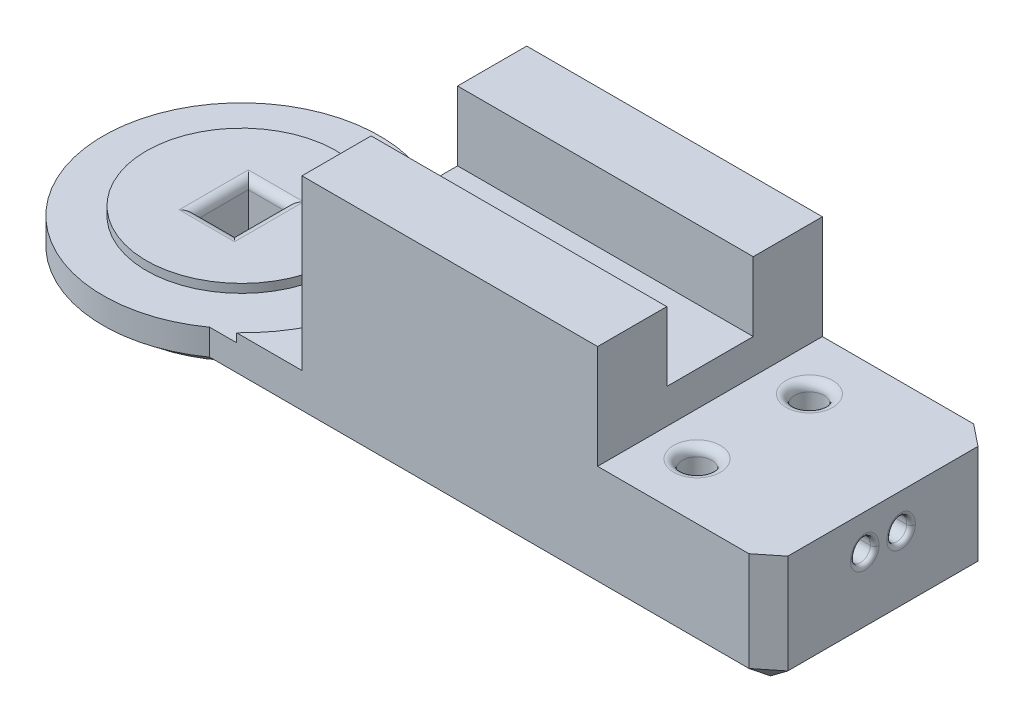
from build123d import *
from OCP.BRepFilletAPI import BRepFilletAPI_MakeChamfer

# Parameters (mm, degrees)
BOSS_EXTRUDE1_DEPTH     = 3
SKETCH2_R               = 9
SKETCH2_R_2             = 5.5
CUT_EXTRUDE1_DEPTH      = 0.5
SKETCH3_W               = 22.1
SKETCH3_H               = 13
BOSS_EXTRUDE2_DEPTH     = 3.75
CUT_EXTRUDE2_DEPTH      = 34.76347879
CUT_EXTRUDE2_DEPTH_BACK = 34.76347879
SKETCH4_R               = 0.85
BOSS_EXTRUDE3_START     = -6.75
SKETCH5_W               = 5
SKETCH5_H               = 13
BOSS_EXTRUDE3_DEPTH     = 6.75
CHAMFER1_SIZE           = 1
CHAMFER1_SIZE2          = 1.25
FILLET1_R               = 0.5
CUT_EXTRUDE3_DEPTH      = 29.503903241
FILLET2_R               = 0.25
SKETCH7_W               = 17.1
SKETCH7_H               = 13
BOSS_EXTRUDE4_DEPTH     = 6
SKETCH8_W               = 17.1
SKETCH8_H               = 5
CUT_EXTRUDE4_DEPTH      = 4


with BuildPart() as part:
    # Sketch1 → Boss-Extrude1 (new body)
    with BuildSketch(Plane(origin=(0, 0, 0), x_dir=(1, 0, 0), z_dir=(0, 1, 0))):
        with BuildLine():
            Line((32.1, 6.5), (4.663689527, 6.5))
            ThreePointArc((4.663689527, 6.5), (-8, 0), (4.663689527, -6.5))
            Line((4.663689527, -6.5), (32.1, -6.5))
            Line((32.1, -6.5), (32.1, 6.5))
        make_face()
        Polygon((-1.1, -1.019803903), (-1.1, 1.019803903), (-1.1, 1.5), (1.1, 1.5), (1.1, 1.019803903), (1.1, -1.019803903), (1.1, -1.5), (-1.1, -1.5), align=None, mode=Mode.SUBTRACT)
    extrude(amount=-BOSS_EXTRUDE1_DEPTH)

    # Sketch2 → Cut-Extrude1 (cut)
    with BuildSketch(Plane(origin=(0, 0, 0), x_dir=(1, 0, 0), z_dir=(0, 1, 0))):
        Circle(SKETCH2_R)
        with Locations(Location((0, 0, 0), (0, 0, 180))):
            Circle(SKETCH2_R_2, mode=Mode.SUBTRACT)
    extrude(amount=-CUT_EXTRUDE1_DEPTH, mode=Mode.SUBTRACT)

    # Sketch3 → Boss-Extrude2 (add)
    with BuildSketch(Plane(origin=(0, 0, 0), x_dir=(1, 0, 0), z_dir=(0, 1, 0))):
        with Locations((21.05, 0)):
            Rectangle(SKETCH3_W, SKETCH3_H)
    extrude(amount=BOSS_EXTRUDE2_DEPTH)

    # Sketch4 → Cut-Extrude2 (cut, two sides: drawn at the far end of the back side and taken through both)
    with BuildSketch(Plane.XZ.offset(3).offset(-CUT_EXTRUDE2_DEPTH_BACK)):
        with Locations((29.6, 3.25)):
            Circle(SKETCH4_R)
        with Locations((29.6, -3.25)):
            Circle(SKETCH4_R)
    extrude(amount=CUT_EXTRUDE2_DEPTH + CUT_EXTRUDE2_DEPTH_BACK, mode=Mode.SUBTRACT)

    # Sketch5 → Boss-Extrude3 (add)
    with BuildSketch(Plane.XZ.offset(3).offset(BOSS_EXTRUDE3_START)):
        with Locations((34.6, 0)):
            Rectangle(SKETCH5_W, SKETCH5_H)
    extrude(amount=BOSS_EXTRUDE3_DEPTH)

    # Chamfer1: one chamfer whose edges measure the first distance from different faces: ONE call of the kernel's chamfer builder (chamfer() names one face for all edges)
    chamfer1_edges_1 = [part.edges().sort_by_distance(p)[0] for p in [
        (20.881844763, -3, -6.5),
    ]]
    chamfer1_side_1 = [part.faces().sort_by_distance(p)[0] for p in [
        (22.311052712, 0.22597976, -6.5),
    ]]
    chamfer1_edges_2 = [part.edges().sort_by_distance(p)[0] for p in [
        (-8, -3, 0),
    ]]
    chamfer1_side_2 = [part.faces().sort_by_distance(p)[0] for p in [
        (-8, -1.75, 0),
    ]]
    chamfer1_edges_3 = [part.edges().sort_by_distance(p)[0] for p in [
        (20.881844763, -3, 6.5),
    ]]
    chamfer1_side_3 = [part.faces().sort_by_distance(p)[0] for p in [
        (22.311052712, 0.22597976, 6.5),
    ]]
    chamfer1_edges_4 = [part.edges().sort_by_distance(p)[0] for p in [
        (37.1, 0.375, 6.5),
        (37.1, 0.375, -6.5),
        (37.1, -3, 0),
    ]]
    chamfer1_side_4 = [part.faces().sort_by_distance(p)[0] for p in [
        (37.1, 0.375, 0),
    ]]
    chamfer1 = BRepFilletAPI_MakeChamfer(part.part.solid().wrapped)
    for e in chamfer1_edges_1:
        chamfer1.Add(CHAMFER1_SIZE, CHAMFER1_SIZE2, e.wrapped, chamfer1_side_1[0].wrapped)  # the first distance lies on this face
    for e in chamfer1_edges_2:
        chamfer1.Add(CHAMFER1_SIZE, CHAMFER1_SIZE2, e.wrapped, chamfer1_side_2[0].wrapped)  # the first distance lies on this face
    for e in chamfer1_edges_3:
        chamfer1.Add(CHAMFER1_SIZE, CHAMFER1_SIZE2, e.wrapped, chamfer1_side_3[0].wrapped)  # the first distance lies on this face
    for e in chamfer1_edges_4:
        chamfer1.Add(CHAMFER1_SIZE, CHAMFER1_SIZE2, e.wrapped, chamfer1_side_4[0].wrapped)  # the first distance lies on this face
    add(Compound.cast(chamfer1.Shape()), mode=Mode.REPLACE)

    # Fillet1
    fillet1_edges = [part.edges().sort_by_distance(p)[0] for p in [
        (1.1, -3, 0),
        (-1.1, 0, 0),
        (0, 0, 1.5),
        (1.1, 0, 0),
        (0, 0, -1.5),
        (0, -3, 1.5),
        (-1.1, -3, 0),
        (28.75, 3.75, 3.25),
        (28.75, -3, 3.25),
        (28.75, 3.75, -3.25),
        (28.75, -3, -3.25),
        (0, -3, -1.5),
    ]]
    fillet(fillet1_edges, radius=FILLET1_R)

    # Sketch6 → Cut-Extrude3 (cut, through all)
    with BuildSketch(Plane.ZY.offset(-10)):
        with BuildLine():
            ThreePointArc((0.475, 1.65), (1.05, 1.075), (1.625, 1.65))
            add(Edge.make_bspline(
                [(1.625, 1.65), (1.625, 2.4), (1.05, 2.4), (0.475, 2.4), (0.475, 1.65)],
                knots=[4.71238898, 4.71238898, 4.71238898, 6.283185307, 6.283185307, 7.853981634, 7.853981634, 7.853981634], degree=2, weights=[1, 0.707106781, 1, 0.707106781, 1]))
        make_face()
        with BuildLine():
            ThreePointArc((-1.625, 1.65), (-1.05, 1.075), (-0.475, 1.65))
            add(Edge.make_bspline(
                [(-0.475, 1.65), (-0.475, 2.4), (-1.05, 2.4), (-1.625, 2.4), (-1.625, 1.65)],
                knots=[4.71238898, 4.71238898, 4.71238898, 6.283185307, 6.283185307, 7.853981634, 7.853981634, 7.853981634], degree=2, weights=[1, 0.707106781, 1, 0.707106781, 1]))
        make_face()
    extrude(amount=-CUT_EXTRUDE3_DEPTH, mode=Mode.SUBTRACT)

    # Fillet2
    fillet2_edges = [part.edges().sort_by_distance(p)[0] for p in [
        (37.1, 2.4, -1.05),
        (37.1, 1.075, -1.05),
        (10, 2.4, -1.05),
        (10, 1.075, -1.05),
        (37.1, 2.4, 1.05),
        (37.1, 1.075, 1.05),
        (10, 2.4, 1.05),
        (10, 1.075, 1.05),
    ]]
    fillet(fillet2_edges, radius=FILLET2_R)

    # Sketch7 → Boss-Extrude4 (add)
    with BuildSketch(Plane(origin=(0, 3.75, 0), x_dir=(1, 0, 0), z_dir=(0, 1, 0))):
        with Locations((18.55, 0)):
            Rectangle(SKETCH7_W, SKETCH7_H)
    extrude(amount=BOSS_EXTRUDE4_DEPTH)

    # Sketch8 → Cut-Extrude4 (cut)
    with BuildSketch(Plane(origin=(0, 9.75, 0), x_dir=(1, 0, 0), z_dir=(0, 1, 0))):
        with Locations((18.55, 0)):
            Rectangle(SKETCH8_W, SKETCH8_H)
    extrude(amount=-CUT_EXTRUDE4_DEPTH, mode=Mode.SUBTRACT)


solid = part.part
